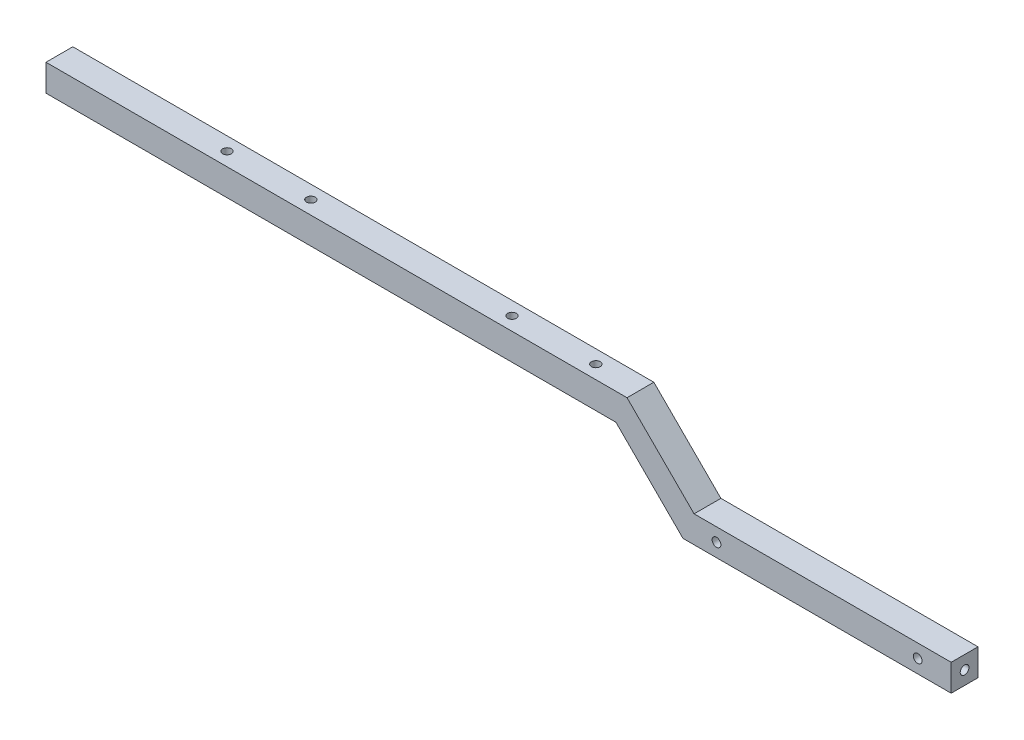
from build123d import *

# Parameters (mm, degrees)
SKETCH2_W           = 8
SKETCH2_H           = 130
BOSS_EXTRUDE1_DEPTH = 8
CUT_EXTRUDE1_REACH  = 67.977
SKETCH4_R           = 1.3
BOSS_EXTRUDE2_DEPTH = 8
SKETCH8_R           = 1.3
CUT_EXTRUDE3_DEPTH  = 10
CUT_EXTRUDE4_REACH  = 169.55
SKETCH9_R           = 1.3
SKETCH10_W          = 40
SKETCH10_H          = 8
BOSS_EXTRUDE3_DEPTH = 8
SKETCH11_R          = 1.3
CUT_EXTRUDE5_DEPTH  = 10


with BuildPart() as part:
    # Sketch2 → Boss-Extrude1 (new body)
    with BuildSketch(Plane(origin=(0, 0, 0), x_dir=(0, 1, 0), z_dir=(0, 0, 1))):
        with Locations((-4, 0)):
            Rectangle(SKETCH2_W, SKETCH2_H)
    extrude(amount=BOSS_EXTRUDE1_DEPTH)

    # Sketch4 → Cut-Extrude1 (cut, up to next)
    with BuildSketch(Plane(origin=(0, 0, 0), x_dir=(-1, 0, 0), z_dir=(0, 1, 0)), mode=Mode.PRIVATE) as cut_extrude1_sk1:
        with Locations((-55, 4)):
            Circle(SKETCH4_R)
    cut_extrude1_tool1 = extrude(cut_extrude1_sk1.sketch, amount=-CUT_EXTRUDE1_REACH, mode=Mode.PRIVATE) & part.part
    # Sketch4 → Cut-Extrude1 (cut, up to next)
    with BuildSketch(Plane(origin=(0, 0, 0), x_dir=(-1, 0, 0), z_dir=(0, 1, 0)), mode=Mode.PRIVATE) as cut_extrude1_sk2:
        with Locations((-30, 4)):
            Circle(SKETCH4_R)
    cut_extrude1_tool2 = extrude(cut_extrude1_sk2.sketch, amount=-CUT_EXTRUDE1_REACH, mode=Mode.PRIVATE) & part.part
    # Sketch4 → Cut-Extrude1 (cut, up to next)
    with BuildSketch(Plane(origin=(0, 0, 0), x_dir=(-1, 0, 0), z_dir=(0, 1, 0)), mode=Mode.PRIVATE) as cut_extrude1_sk3:
        with Locations((30, 4)):
            Circle(SKETCH4_R)
    cut_extrude1_tool3 = extrude(cut_extrude1_sk3.sketch, amount=-CUT_EXTRUDE1_REACH, mode=Mode.PRIVATE) & part.part
    # Sketch4 → Cut-Extrude1 (cut, up to next)
    with BuildSketch(Plane(origin=(0, 0, 0), x_dir=(-1, 0, 0), z_dir=(0, 1, 0)), mode=Mode.PRIVATE) as cut_extrude1_sk4:
        with Locations((55, 4)):
            Circle(SKETCH4_R)
    cut_extrude1_tool4 = extrude(cut_extrude1_sk4.sketch, amount=-CUT_EXTRUDE1_REACH, mode=Mode.PRIVATE) & part.part
    add(cut_extrude1_tool1.solids().sort_by_distance((55, 0, 4))[0], mode=Mode.SUBTRACT)
    add(cut_extrude1_tool2.solids().sort_by_distance((30, 0, 4))[0], mode=Mode.SUBTRACT)
    add(cut_extrude1_tool3.solids().sort_by_distance((-30, 0, 4))[0], mode=Mode.SUBTRACT)
    add(cut_extrude1_tool4.solids().sort_by_distance((-55, 0, 4))[0], mode=Mode.SUBTRACT)

    # Sketch7 → Boss-Extrude2 (add)
    with BuildSketch(Plane(origin=(0, 0, 0), x_dir=(1, 0, 0), z_dir=(0, 0, -1))):
        Polygon((65, 8), (85, 28), (165, 28), (165, 20), (88.313708499, 20), (68.313708499, 0), (65, 0), align=None)
    extrude(amount=-BOSS_EXTRUDE2_DEPTH)

    # Sketch8 → Cut-Extrude3 (cut)
    with BuildSketch(Plane.YZ.offset(165)):
        with Locations(Location((-24, 4, 0), (0, 0, 270))):
            Circle(SKETCH8_R)
    extrude(amount=-CUT_EXTRUDE3_DEPTH, mode=Mode.SUBTRACT)

    # Sketch9 → Cut-Extrude4 (cut, up to next)
    with BuildSketch(Plane(origin=(0, 0, 0), x_dir=(1, 0, 0), z_dir=(0, 0, -1)), mode=Mode.PRIVATE) as cut_extrude4_sk1:
        with Locations(Location((95, 24, 0), (0, 0, 180))):
            Circle(SKETCH9_R)
    cut_extrude4_tool1 = extrude(cut_extrude4_sk1.sketch, amount=-CUT_EXTRUDE4_REACH, mode=Mode.PRIVATE) & part.part
    # Sketch9 → Cut-Extrude4 (cut, up to next)
    with BuildSketch(Plane(origin=(0, 0, 0), x_dir=(1, 0, 0), z_dir=(0, 0, -1)), mode=Mode.PRIVATE) as cut_extrude4_sk2:
        with Locations((155, 24)):
            Circle(SKETCH9_R)
    cut_extrude4_tool2 = extrude(cut_extrude4_sk2.sketch, amount=-CUT_EXTRUDE4_REACH, mode=Mode.PRIVATE) & part.part
    add(cut_extrude4_tool1.solids().sort_by_distance((95, -24, 0))[0], mode=Mode.SUBTRACT)
    add(cut_extrude4_tool2.solids().sort_by_distance((155, -24, 0))[0], mode=Mode.SUBTRACT)

    # Sketch10 → Boss-Extrude3 (add)
    with BuildSketch(Plane.XY.offset(8)):
        with Locations((-85, -4)):
            Rectangle(SKETCH10_W, SKETCH10_H)
    extrude(amount=-BOSS_EXTRUDE3_DEPTH)

    # Sketch11 → Cut-Extrude5 (cut)
    with BuildSketch(Plane(origin=(-105, 0, 0), x_dir=(0, -1, 0), z_dir=(-1, 0, 0))):
        with Locations(Location((4, 4, 0), (0, 0, 90))):
            Circle(SKETCH11_R)
    extrude(amount=-CUT_EXTRUDE5_DEPTH, mode=Mode.SUBTRACT)


solid = part.part
